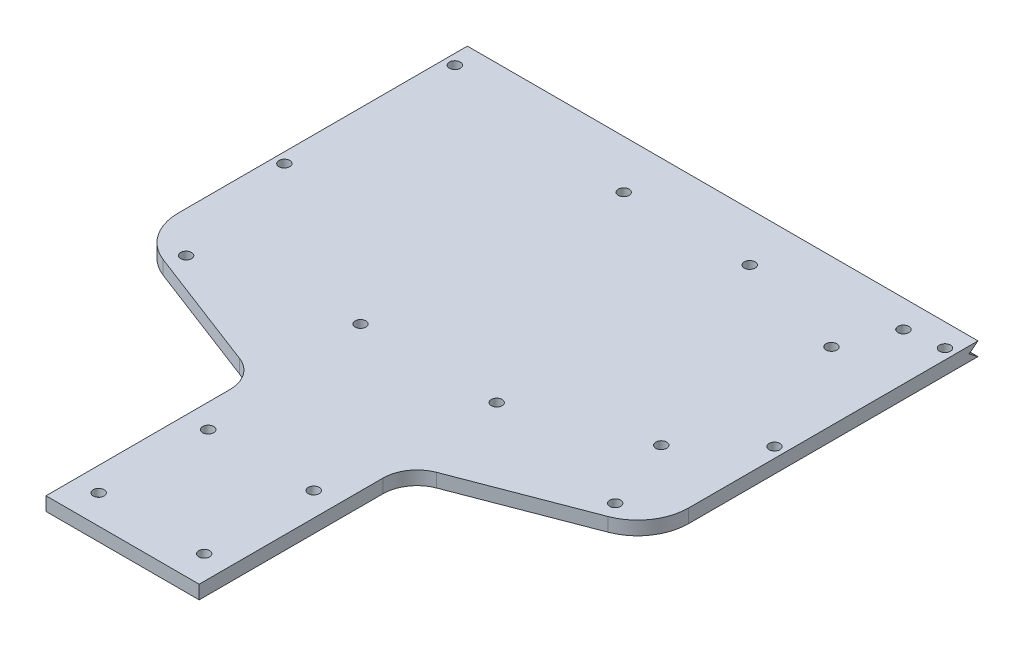
from build123d import *
from build123d.topology import SkipClean

# Parameters (mm, degrees)
BOSS_EXTRU_1_DEPTH                          = 4
FRAISAGE_POUR_VIS_T_TE_FRAIS_E_M31_AT_COUNT = 2
FRAISAGE_POUR_VIS_T_TE_FRAIS_E_M31_AT_PITCH = 37
FRAISAGE_POUR_VIS_T_TE_FRAIS_E_M31_2_COUNT  = 2
FRAISAGE_POUR_VIS_T_TE_FRAIS_E_M31_2_PITCH  = 76.24923343876974
FRAISAGE_POUR_VIS_T_TE_FRAIS_E_M31_3_COUNT  = 2
FRAISAGE_POUR_VIS_T_TE_FRAIS_E_M31_3_PITCH  = 84.16380219548068
FRAISAGE_POUR_VIS_T_TE_FRAIS_E_M31_4_COUNT  = 2
FRAISAGE_POUR_VIS_T_TE_FRAIS_E_M31_4_PITCH  = 48.91829923454004
FRAISAGE_POUR_VIS_T_TE_FRAIS_E_M31_5_COUNT  = 2
FRAISAGE_POUR_VIS_T_TE_FRAIS_E_M31_5_PITCH  = 32
FRAISAGE_POUR_VIS_T_TE_FRAIS_E_M31_6_COUNT  = 2
FRAISAGE_POUR_VIS_T_TE_FRAIS_E_M31_6_PITCH  = 146.22144473366413
FRAISAGE_POUR_VIS_T_TE_FRAIS_E_M31_7_COUNT  = 2
FRAISAGE_POUR_VIS_T_TE_FRAIS_E_M31_7_PITCH  = 149.33656919857233
FRAISAGE_POUR_VIS_T_TE_FRAIS_E_M31_8_COUNT  = 2
FRAISAGE_POUR_VIS_T_TE_FRAIS_E_M31_8_PITCH  = 178.221185328793
FRAISAGE_POUR_VIS_T_TE_FRAIS_E_M31_9_COUNT  = 2
FRAISAGE_POUR_VIS_T_TE_FRAIS_E_M31_9_PITCH  = 180.7857596714962
FRAISAGE_POUR_VIS_T_TE_FRAIS_E_M31_10_COUNT = 2
FRAISAGE_POUR_VIS_T_TE_FRAIS_E_M31_10_PITCH = 93.72201084432365
FRAISAGE_POUR_VIS_T_TE_FRAIS_E_M31_11_COUNT = 2
FRAISAGE_POUR_VIS_T_TE_FRAIS_E_M31_11_PITCH = 71.25422011407208
FRAISAGE_POUR_VIS_T_TE_FRAIS_E_M31_12_COUNT = 2
FRAISAGE_POUR_VIS_T_TE_FRAIS_E_M31_12_PITCH = 81.13852320176049
FRAISAGE_POUR_VIS_T_TE_FRAIS_E_M31_13_COUNT = 2
FRAISAGE_POUR_VIS_T_TE_FRAIS_E_M31_13_PITCH = 110.20788746644998
FRAISAGE_POUR_VIS_T_TE_FRAIS_E_M31_14_COUNT = 2
FRAISAGE_POUR_VIS_T_TE_FRAIS_E_M31_14_PITCH = 120.18099085718585
FRAISAGE_POUR_VIS_T_TE_FRAIS_E_M31_15_COUNT = 2
FRAISAGE_POUR_VIS_T_TE_FRAIS_E_M31_15_PITCH = 126.59408322917878
FRAISAGE_POUR_VIS_T_TE_FRAIS_E_M31_16_COUNT = 2
FRAISAGE_POUR_VIS_T_TE_FRAIS_E_M31_16_PITCH = 126.7178805041533
FRAISAGE_POUR_VIS_T_TE_FRAIS_E_M31_17_COUNT = 2
FRAISAGE_POUR_VIS_T_TE_FRAIS_E_M31_17_PITCH = 104.21257096609138
FRAISAGE_POUR_VIS_T_TE_FRAIS_E_M31_18_COUNT = 2
FRAISAGE_POUR_VIS_T_TE_FRAIS_E_M31_18_PITCH = 111.92649207746531
FRAISAGE_POUR_VIS_T_TE_FRAIS_E_M31_19_COUNT = 2
FRAISAGE_POUR_VIS_T_TE_FRAIS_E_M31_19_PITCH = 96.71589261369941
FRAISAGE_POUR_VIS_T_TE_FRAIS_E_M31_20_COUNT = 2
FRAISAGE_POUR_VIS_T_TE_FRAIS_E_M31_20_PITCH = 72.36181435608123
FRAISAGE_POUR_VIS_T_TE_FRAIS_E_M31_21_COUNT = 2
FRAISAGE_POUR_VIS_T_TE_FRAIS_E_M31_21_PITCH = 80.15130801742393
FRAISAGE_POUR_VIS_T_TE_FRAIS_E_M31_22_COUNT = 2
FRAISAGE_POUR_VIS_T_TE_FRAIS_E_M31_22_PITCH = 87.17495569256108
FRAISAGE_POUR_VIS_T_TE_FRAIS_E_M31_23_COUNT = 2
FRAISAGE_POUR_VIS_T_TE_FRAIS_E_M31_23_PITCH = 57.64263092538352
FRAISAGE_POUR_VIS_T_TE_FRAIS_E_M31_24_COUNT = 2
FRAISAGE_POUR_VIS_T_TE_FRAIS_E_M31_24_PITCH = 91.32999562027801
FRAISAGE_POUR_VIS_T_TE_FRAIS_E_M31_25_COUNT = 2
FRAISAGE_POUR_VIS_T_TE_FRAIS_E_M31_25_PITCH = 70.40715943709135
ENL_V_MAT_EXTRU_1_REACH                     = 195.197
ENL_V_MAT_EXTRU_1_DIRECTION_2_REACH         = 195.197
ENL_V_MAT_EXTRU_2_REACH                     = 229.727


with BuildPart() as part:
    # Esquisse1 → Boss.-Extru.1 (new body)
    with BuildSketch(Plane.XZ):
        with BuildLine():
            Line((22.499999999999876, 171.3), (22.499999999999876, 117.30000000000001))
            ThreePointArc((22.499999999999876, 117.30000000000001), (24.261102018221273, 111.63249966512188), (28.924112009168745, 107.96120858584864))
            Line((28.924112009168745, 107.96120858584864), (65.36383198624648, 94.00818712122728))
            ThreePointArc((65.36383198624648, 94.00818712122728), (72.35834697266782, 88.50125050231733), (75, 80))
            Line((75, 80), (75, -80))
            ThreePointArc((75, -80), (72.93707319873252, -87.59158330327982), (67.31571505991508, -93.09504918517422))
            Line((67.31571505991508, -93.09504918517422), (27.62285662672306, -115.269967209884))
            ThreePointArc((27.62285662672306, -115.269967209884), (23.875284534178178, -118.9389444644802), (22.499999999999876, -124))
            Line((22.499999999999876, -124), (22.499999999999876, -178))
            Line((22.499999999999876, -178), (-22.499999999999876, -178))
            Line((-22.499999999999876, -178), (-22.499999999999876, -123.99999999999999))
            ThreePointArc((-22.499999999999876, -123.99999999999999), (-23.875284534178174, -118.9389444644802), (-27.62285662672306, -115.269967209884))
            Line((-27.62285662672306, -115.269967209884), (-67.31571505991508, -93.09504918517422))
            ThreePointArc((-67.31571505991508, -93.09504918517422), (-72.93707319873253, -87.59158330327982), (-75.00000000000001, -80))
            Line((-75.00000000000001, -80), (-75.00000000000001, 80))
            ThreePointArc((-75.00000000000001, 80), (-72.35834697266783, 88.50125050231735), (-65.36383198624651, 94.0081871212273))
            Line((-65.36383198624651, 94.0081871212273), (-28.92411200916875, 107.96120858584864))
            ThreePointArc((-28.92411200916875, 107.96120858584864), (-24.261102018221276, 111.63249966512188), (-22.499999999999876, 117.30000000000001))
            Line((-22.499999999999876, 117.30000000000001), (-22.499999999999876, 171.3))
            Line((-22.499999999999876, 171.3), (22.499999999999876, 171.3))
        make_face()
    extrude(amount=BOSS_EXTRU_1_DEPTH)

    # Esquisse2 → Fraisage pour vis à tête fraisée M31 (revolve, cut)
    with BuildSketch(Plane(origin=(-14.85000000000002, -4, 9.219999999999999), x_dir=(0, 0, -1), z_dir=(1, 0, 0))):
        Polygon((0, 0), (-9.8e-16, 4), (1.599999999999999, 4), (1.5999999999999996, 1.6999999999999948), (2.899999999999998, 0.3999999999999993), (2.9, -3.47e-15), align=None)
    fraisage_pour_vis_t_te_frais_e_m31 = revolve(axis=Axis((-14.85000000000002, -10.34999999999999, 9.219999999999999), (0, 1, 0)), mode=Mode.SUBTRACT)

    # Fraisage pour vis à tête fraisée M31 at: Fraisage pour vis à tête fraisée M31 ×2
    with Locations(*[(i * FRAISAGE_POUR_VIS_T_TE_FRAIS_E_M31_AT_PITCH, 0, 0) for i in range(1, FRAISAGE_POUR_VIS_T_TE_FRAIS_E_M31_AT_COUNT)]):
        add(fraisage_pour_vis_t_te_frais_e_m31, mode=Mode.SUBTRACT)

    # Fraisage pour vis _ t_te frais_e M31 2: Fraisage pour vis à tête fraisée M31 ×2
    with Locations(*[Vector(0.9967313318766692, 0, -0.08078769742579317) * (i * FRAISAGE_POUR_VIS_T_TE_FRAIS_E_M31_2_PITCH) for i in range(1, FRAISAGE_POUR_VIS_T_TE_FRAIS_E_M31_2_COUNT)]):
        add(fraisage_pour_vis_t_te_frais_e_m31, mode=Mode.SUBTRACT)

    # Fraisage pour vis _ t_te frais_e M31 3: Fraisage pour vis à tête fraisée M31 ×2
    with Locations(*[Vector(0.903001029153611, 0, -0.429638384397297) * (i * FRAISAGE_POUR_VIS_T_TE_FRAIS_E_M31_3_PITCH) for i in range(1, FRAISAGE_POUR_VIS_T_TE_FRAIS_E_M31_3_COUNT)]):
        add(fraisage_pour_vis_t_te_frais_e_m31, mode=Mode.SUBTRACT)

    # Fraisage pour vis _ t_te frais_e M31 4: Fraisage pour vis à tête fraisée M31 ×2
    with Locations(*[Vector(0.7563631724521444, 0, -0.6541519329315842) * (i * FRAISAGE_POUR_VIS_T_TE_FRAIS_E_M31_4_PITCH) for i in range(1, FRAISAGE_POUR_VIS_T_TE_FRAIS_E_M31_4_COUNT)]):
        add(fraisage_pour_vis_t_te_frais_e_m31, mode=Mode.SUBTRACT)

    # Fraisage pour vis _ t_te frais_e M31 5: Fraisage pour vis à tête fraisée M31 ×2
    with Locations(*[(0, 0, -i * FRAISAGE_POUR_VIS_T_TE_FRAIS_E_M31_5_PITCH) for i in range(1, FRAISAGE_POUR_VIS_T_TE_FRAIS_E_M31_5_COUNT)]):
        add(fraisage_pour_vis_t_te_frais_e_m31, mode=Mode.SUBTRACT)

    # Fraisage pour vis _ t_te frais_e M31 6: Fraisage pour vis à tête fraisée M31 ×2
    with Locations(*[Vector(-0.004445312390285126, 0, -0.9999901195500648) * (i * FRAISAGE_POUR_VIS_T_TE_FRAIS_E_M31_6_PITCH) for i in range(1, FRAISAGE_POUR_VIS_T_TE_FRAIS_E_M31_6_COUNT)]):
        add(fraisage_pour_vis_t_te_frais_e_m31, mode=Mode.SUBTRACT)

    # Fraisage pour vis _ t_te frais_e M31 7: Fraisage pour vis à tête fraisée M31 ×2
    with Locations(*[Vector(0.2032322033569929, 0, -0.9791305691881251) * (i * FRAISAGE_POUR_VIS_T_TE_FRAIS_E_M31_7_PITCH) for i in range(1, FRAISAGE_POUR_VIS_T_TE_FRAIS_E_M31_7_COUNT)]):
        add(fraisage_pour_vis_t_te_frais_e_m31, mode=Mode.SUBTRACT)

    # Fraisage pour vis _ t_te frais_e M31 8: Fraisage pour vis à tête fraisée M31 ×2
    with Locations(*[Vector(-0.003647153388643399, 0, -0.9999933491139628) * (i * FRAISAGE_POUR_VIS_T_TE_FRAIS_E_M31_8_PITCH) for i in range(1, FRAISAGE_POUR_VIS_T_TE_FRAIS_E_M31_8_COUNT)]):
        add(fraisage_pour_vis_t_te_frais_e_m31, mode=Mode.SUBTRACT)

    # Fraisage pour vis _ t_te frais_e M31 9: Fraisage pour vis à tête fraisée M31 ×2
    with Locations(*[Vector(0.16787826682338555, 0, -0.9858077335507042) * (i * FRAISAGE_POUR_VIS_T_TE_FRAIS_E_M31_9_PITCH) for i in range(1, FRAISAGE_POUR_VIS_T_TE_FRAIS_E_M31_9_COUNT)]):
        add(fraisage_pour_vis_t_te_frais_e_m31, mode=Mode.SUBTRACT)

    # Fraisage pour vis _ t_te frais_e M31 10: Fraisage pour vis à tête fraisée M31 ×2
    with Locations(*[Vector(-0.5140271894002647, 0, 0.8577738912774534) * (i * FRAISAGE_POUR_VIS_T_TE_FRAIS_E_M31_10_PITCH) for i in range(1, FRAISAGE_POUR_VIS_T_TE_FRAIS_E_M31_10_COUNT)]):
        add(fraisage_pour_vis_t_te_frais_e_m31, mode=Mode.SUBTRACT)

    # Fraisage pour vis _ t_te frais_e M31 11: Fraisage pour vis à tête fraisée M31 ×2
    with Locations(*[Vector(-0.8020577575406399, 0, 0.5972464763972075) * (i * FRAISAGE_POUR_VIS_T_TE_FRAIS_E_M31_11_PITCH) for i in range(1, FRAISAGE_POUR_VIS_T_TE_FRAIS_E_M31_11_COUNT)]):
        add(fraisage_pour_vis_t_te_frais_e_m31, mode=Mode.SUBTRACT)

    # Fraisage pour vis _ t_te frais_e M31 12: Fraisage pour vis à tête fraisée M31 ×2
    with Locations(*[Vector(-0.7043510005461847, 0, -0.7098518634402452) * (i * FRAISAGE_POUR_VIS_T_TE_FRAIS_E_M31_12_PITCH) for i in range(1, FRAISAGE_POUR_VIS_T_TE_FRAIS_E_M31_12_COUNT)]):
        add(fraisage_pour_vis_t_te_frais_e_m31, mode=Mode.SUBTRACT)

    # Fraisage pour vis _ t_te frais_e M31 13: Fraisage pour vis à tête fraisée M31 ×2
    with Locations(*[Vector(-0.4627851347160459, 0, -0.8864704840466214) * (i * FRAISAGE_POUR_VIS_T_TE_FRAIS_E_M31_13_PITCH) for i in range(1, FRAISAGE_POUR_VIS_T_TE_FRAIS_E_M31_13_COUNT)]):
        add(fraisage_pour_vis_t_te_frais_e_m31, mode=Mode.SUBTRACT)

    # Fraisage pour vis _ t_te frais_e M31 14: Fraisage pour vis à tête fraisée M31 ×2
    with Locations(*[Vector(-0.09812659935351496, 0, -0.9951739398212329) * (i * FRAISAGE_POUR_VIS_T_TE_FRAIS_E_M31_14_PITCH) for i in range(1, FRAISAGE_POUR_VIS_T_TE_FRAIS_E_M31_14_COUNT)]):
        add(fraisage_pour_vis_t_te_frais_e_m31, mode=Mode.SUBTRACT)

    # Fraisage pour vis _ t_te frais_e M31 15: Fraisage pour vis à tête fraisée M31 ×2
    with Locations(*[Vector(0.32776375389231355, 0, -0.9447597163482464) * (i * FRAISAGE_POUR_VIS_T_TE_FRAIS_E_M31_15_PITCH) for i in range(1, FRAISAGE_POUR_VIS_T_TE_FRAIS_E_M31_15_COUNT)]):
        add(fraisage_pour_vis_t_te_frais_e_m31, mode=Mode.SUBTRACT)

    # Fraisage pour vis _ t_te frais_e M31 16: Fraisage pour vis à tête fraisée M31 ×2
    with Locations(*[Vector(0.6368680704479339, 0, -0.770972801623978) * (i * FRAISAGE_POUR_VIS_T_TE_FRAIS_E_M31_16_PITCH) for i in range(1, FRAISAGE_POUR_VIS_T_TE_FRAIS_E_M31_16_COUNT)]):
        add(fraisage_pour_vis_t_te_frais_e_m31, mode=Mode.SUBTRACT)

    # Fraisage pour vis _ t_te frais_e M31 17: Fraisage pour vis à tête fraisée M31 ×2
    with Locations(*[Vector(0.8333927394254491, 0, -0.5526812298902014) * (i * FRAISAGE_POUR_VIS_T_TE_FRAIS_E_M31_17_PITCH) for i in range(1, FRAISAGE_POUR_VIS_T_TE_FRAIS_E_M31_17_COUNT)]):
        add(fraisage_pour_vis_t_te_frais_e_m31, mode=Mode.SUBTRACT)

    # Fraisage pour vis _ t_te frais_e M31 18: Fraisage pour vis à tête fraisée M31 ×2
    with Locations(*[Vector(0.6957750607010041, 0, 0.7182597475193178) * (i * FRAISAGE_POUR_VIS_T_TE_FRAIS_E_M31_18_PITCH) for i in range(1, FRAISAGE_POUR_VIS_T_TE_FRAIS_E_M31_18_COUNT)]):
        add(fraisage_pour_vis_t_te_frais_e_m31, mode=Mode.SUBTRACT)

    # Fraisage pour vis _ t_te frais_e M31 19: Fraisage pour vis à tête fraisée M31 ×2
    with Locations(*[Vector(0.8979909883776221, 0, 0.4400138461373474) * (i * FRAISAGE_POUR_VIS_T_TE_FRAIS_E_M31_19_PITCH) for i in range(1, FRAISAGE_POUR_VIS_T_TE_FRAIS_E_M31_19_COUNT)]):
        add(fraisage_pour_vis_t_te_frais_e_m31, mode=Mode.SUBTRACT)

    # Fraisage pour vis _ t_te frais_e M31 20: Fraisage pour vis à tête fraisée M31 ×2
    with Locations(*[Vector(-0.07117013366549435, 0, 0.9974641908730537) * (i * FRAISAGE_POUR_VIS_T_TE_FRAIS_E_M31_20_PITCH) for i in range(1, FRAISAGE_POUR_VIS_T_TE_FRAIS_E_M31_20_COUNT)]):
        add(fraisage_pour_vis_t_te_frais_e_m31, mode=Mode.SUBTRACT)

    # Fraisage pour vis _ t_te frais_e M31 21: Fraisage pour vis à tête fraisée M31 ×2
    with Locations(*[Vector(0.43480263593981594, 0, 0.9005257729680967) * (i * FRAISAGE_POUR_VIS_T_TE_FRAIS_E_M31_21_PITCH) for i in range(1, FRAISAGE_POUR_VIS_T_TE_FRAIS_E_M31_21_COUNT)]):
        add(fraisage_pour_vis_t_te_frais_e_m31, mode=Mode.SUBTRACT)

    # Fraisage pour vis _ t_te frais_e M31 22: Fraisage pour vis à tête fraisée M31 ×2
    with Locations(*[Vector(0.9962723732982764, 0, -0.08626330739439464) * (i * FRAISAGE_POUR_VIS_T_TE_FRAIS_E_M31_22_PITCH) for i in range(1, FRAISAGE_POUR_VIS_T_TE_FRAIS_E_M31_22_COUNT)]):
        add(fraisage_pour_vis_t_te_frais_e_m31, mode=Mode.SUBTRACT)

    # Fraisage pour vis _ t_te frais_e M31 23: Fraisage pour vis à tête fraisée M31 ×2
    with Locations(*[Vector(-0.9914537050534457, 0, -0.1304590002100094) * (i * FRAISAGE_POUR_VIS_T_TE_FRAIS_E_M31_23_PITCH) for i in range(1, FRAISAGE_POUR_VIS_T_TE_FRAIS_E_M31_23_COUNT)]):
        add(fraisage_pour_vis_t_te_frais_e_m31, mode=Mode.SUBTRACT)

    # Fraisage pour vis _ t_te frais_e M31 24: Fraisage pour vis à tête fraisée M31 ×2
    with Locations(*[Vector(0.7648089713089968, 0, 0.6442571205700983) * (i * FRAISAGE_POUR_VIS_T_TE_FRAIS_E_M31_24_PITCH) for i in range(1, FRAISAGE_POUR_VIS_T_TE_FRAIS_E_M31_24_COUNT)]):
        add(fraisage_pour_vis_t_te_frais_e_m31, mode=Mode.SUBTRACT)

    # Fraisage pour vis _ t_te frais_e M31 25: Fraisage pour vis à tête fraisée M31 ×2
    with Locations(*[Vector(0.9920866082150472, 0, 0.12555541326586997) * (i * FRAISAGE_POUR_VIS_T_TE_FRAIS_E_M31_25_PITCH) for i in range(1, FRAISAGE_POUR_VIS_T_TE_FRAIS_E_M31_25_COUNT)]):
        add(fraisage_pour_vis_t_te_frais_e_m31, mode=Mode.SUBTRACT)

    # Esquisse4 → Enlèvement de matière-Révolution1 (revolve, cut)
    with BuildSketch(Plane(origin=(15.500000000000005, 1.9e-16, 1.67e-15), x_dir=(1.1e-16, 0, -1), z_dir=(1, 1e-17, 1.1e-16)), mode=Mode.PRIVATE) as enl_vement_de_mati_re_r_volution1_sk:
        Polygon((-130.4423272452082, 1.971907347075363), (-128.85109221261894, 1.8046618058471149), (-129.26920606568953, -2.173425775625958), (-128.11221460395873, -3.602191241852692), (-128.2177470175982, -4.606265086952411), (-131.1018605141662, -4.30313254347621), align=None)
    enl_vement_de_mati_re_r_volution1 = revolve(enl_vement_de_mati_re_r_volution1_sk.sketch.rotate(Axis((15.499999999999991, 1.971907347075363, 130.4423272452082), (0, -0.9945218953682737, 0.10452846326764959)), 180), axis=Axis((15.499999999999991, 1.971907347075363, 130.4423272452082), (0, -0.9945218953682737, 0.10452846326764959)), mode=Mode.SUBTRACT)

    # Esquisse5 → Enlèvement de matière-Révolution2 (revolve, cut)
    with SkipClean():  # the faces are left unmerged after this step: merging them gives an invalid solid
        with BuildSketch(Plane(origin=(15.500000000000005, 1.9e-16, 1.67e-15), x_dir=(1.1e-16, 0, -1), z_dir=(1, 1e-17, 1.1e-16)), mode=Mode.PRIVATE) as enl_vement_de_mati_re_r_volution2_sk:
            Polygon((-162.75554285983117, 0.6689087738567335), (-161.1643078272419, 0.5016632326284988), (-161.44525888924028, -2.1714075650249045), (-160.28489861420792, -3.6025712577293647), (-160.33017989971506, -4), (-160.39925771146042, -4.606288172548205), (-163.2781851761694, -4.303700702984637), align=None)
        enl_vement_de_mati_re_r_volution2 = revolve(enl_vement_de_mati_re_r_volution2_sk.sketch.rotate(Axis((15.499999999999988, 0.6689087738567338, 162.75554285983117), (0, -0.9945218953682743, 0.10452846326764464)), 180), axis=Axis((15.499999999999988, 0.6689087738567338, 162.75554285983117), (0, -0.9945218953682743, 0.10452846326764464)), mode=Mode.SUBTRACT)

    # Symétrie1: Enlèvement de matière-Révolution1, Enlèvement de matière-Révolution2 across plane
    with SkipClean():  # the faces are left unmerged after this step: merging them gives an invalid solid
        add(enl_vement_de_mati_re_r_volution1.mirror(Plane(origin=(0, 0, 0), x_dir=(0, 0, 1), z_dir=(1, 0, 0))), mode=Mode.SUBTRACT)
        add(enl_vement_de_mati_re_r_volution2.mirror(Plane(origin=(0, 0, 0), x_dir=(0, 0, 1), z_dir=(1, 0, 0))), mode=Mode.SUBTRACT)

    # Esquisse7 → Enlèv. mat.-Extru.1 (cut, up to next)
    with BuildSketch(Plane(origin=(0, 0, 0), x_dir=(0, 0, -1), z_dir=(1, 0, 0)), mode=Mode.PRIVATE) as enl_v_mat_extru_1_sk1:
        Polygon((5, 1.45e-15), (178, 0), (178, -4.0000000000000036), (5.000000000000001, -4), align=None)
    enl_v_mat_extru_1_tool1 = extrude(enl_v_mat_extru_1_sk1.sketch, amount=-ENL_V_MAT_EXTRU_1_REACH, mode=Mode.PRIVATE) & part.part
    add(enl_v_mat_extru_1_tool1.solids().sort_by_distance((0, -2, -91.5))[0], mode=Mode.SUBTRACT)

    # Esquisse7 → Enlèv. mat.-Extru.1 direction 2 (cut, up to next)
    with BuildSketch(Plane(origin=(0, 0, 0), x_dir=(0, 0, -1), z_dir=(1, 0, 0)), mode=Mode.PRIVATE) as enl_v_mat_extru_1_direction_2_sk1:
        Polygon((5, 1.45e-15), (178, 0), (178, -4.0000000000000036), (5.000000000000001, -4), align=None)
    enl_v_mat_extru_1_direction_2_tool1 = extrude(enl_v_mat_extru_1_direction_2_sk1.sketch, amount=ENL_V_MAT_EXTRU_1_DIRECTION_2_REACH, mode=Mode.PRIVATE) & part.part
    add(enl_v_mat_extru_1_direction_2_tool1.solids().sort_by_distance((0, -2, -91.5))[0], mode=Mode.SUBTRACT)

    # Esquisse8 → Enlèv. mat.-Extru.2 (cut, up to next)
    with BuildSketch(Plane(origin=(75, 0, 0), x_dir=(0, 0, -1), z_dir=(1, 0, 0)), mode=Mode.PRIVATE) as enl_v_mat_extru_2_sk1:
        Polygon((5.000000000000004, 0), (2.3935492543175814, -2), (5.000000000000004, -4), align=None)
    enl_v_mat_extru_2_tool1 = extrude(enl_v_mat_extru_2_sk1.sketch, amount=-ENL_V_MAT_EXTRU_2_REACH, mode=Mode.PRIVATE) & part.part
    add(enl_v_mat_extru_2_tool1.solids().sort_by_distance((75, -2, -4.131183))[0], mode=Mode.SUBTRACT)


solid = part.part
